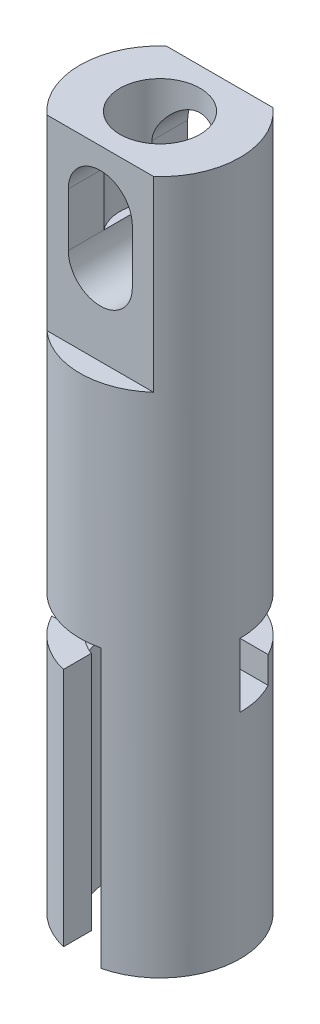
from build123d import *

# Parameters (mm, degrees)
SKETCH1_R                = 15
BOSS_EXTRUDE1_DEPTH      = 75
CUT_EXTRUDE1_DEPTH       = 52
CUT_EXTRUDE2_DEPTH       = 3.5
SKETCH9_R                = 10
CUT_EXTRUDE12_DEPTH      = 70
SKETCH17_W               = 7
SKETCH17_H               = 12
CUT_EXTRUDE19_DEPTH      = 15
SKETCH19_W               = 7
SKETCH19_H               = 12
CUT_EXTRUDE20_DEPTH      = 15
SKETCH20_R               = 7.5
CUT_EXTRUDE21_DEPTH      = 40
CUT_EXTRUDE25_DEPTH      = 152.492574075
CUT_EXTRUDE25_DEPTH_BACK = 55
SKETCH21_W               = 20
SKETCH21_H               = 7.639320226
CUT_EXTRUDE28_DEPTH      = 152.492574075
CUT_EXTRUDE28_DEPTH_BACK = 10
SKETCH24_R               = 15
SKETCH25_R               = 15
CUT_EXTRUDE29_DEPTH      = 10
CUT_EXTRUDE30_DEPTH      = 81.841883926
CUT_EXTRUDE30_DEPTH_BACK = 81.841883926


with BuildPart() as part:
    # Sketch1 → Boss-Extrude1 (new, symmetric)
    with BuildSketch(Plane(origin=(0, 0, 0), x_dir=(1, 0, 0), z_dir=(0, 1, 0))):
        with Locations(Location((0, 0, 0), (0, 0, 270))):
            Circle(SKETCH1_R)
    extrude(amount=BOSS_EXTRUDE1_DEPTH, both=True)

    # Sketch2 → Cut-Extrude1 (cut)
    with BuildSketch(Plane.XZ.offset(75)):
        with BuildLine():
            Line((3.5, 15), (3.5, -15))
            ThreePointArc((3.5, -15), (0, -18.5), (-3.5, -15))
            Line((-3.5, -15), (-3.5, 15))
            ThreePointArc((-3.5, 15), (0, 18.5), (3.5, 15))
        make_face()
    extrude(amount=-CUT_EXTRUDE1_DEPTH, mode=Mode.SUBTRACT)

    # Sketch3 → Cut-Extrude2 (cut, symmetric)
    with BuildSketch(Plane(origin=(0, -26.5, 0), x_dir=(1, 0, 0), z_dir=(0, 1, 0))):
        Polygon((-14.980069936, 0), (-15.328117643, -9.993941304), (-0.348047707, -16.993941304), (0, -7), align=None)
        Polygon((15, 0), (0, 7), (0.348047707, 16.993941304), (15.348047707, 9.993941304), align=None)
    extrude(amount=CUT_EXTRUDE2_DEPTH, both=True, mode=Mode.SUBTRACT)

    # Sketch9 → Cut-Extrude12 (cut)
    with BuildSketch(Plane.XZ.offset(75)):
        with Locations(Location((0, 0, 0), (0, 0, 270))):
            Circle(SKETCH9_R)
    extrude(amount=-CUT_EXTRUDE12_DEPTH, mode=Mode.SUBTRACT)

    # Sketch17 → Cut-Extrude19 (cut)
    with BuildSketch(Plane(origin=(15, 0, 0), x_dir=(0, 0, -1), z_dir=(1, 0, 0))):
        with Locations((3.5, -29)):
            Rectangle(SKETCH17_W, SKETCH17_H)
    extrude(amount=-CUT_EXTRUDE19_DEPTH, mode=Mode.SUBTRACT)

    # Sketch19 → Cut-Extrude20 (cut)
    with BuildSketch(Plane.ZY.offset(15)):
        with Locations((3.5, -29)):
            Rectangle(SKETCH19_W, SKETCH19_H)
    extrude(amount=-CUT_EXTRUDE20_DEPTH, mode=Mode.SUBTRACT)

    # Sketch20 → Cut-Extrude21 (cut)
    with BuildSketch(Plane(origin=(0, 75, 0), x_dir=(1, 0, 0), z_dir=(0, 1, 0))):
        with Locations(Location((0, 0, 0), (0, 0, 270))):
            Circle(SKETCH20_R)
    extrude(amount=-CUT_EXTRUDE21_DEPTH, mode=Mode.SUBTRACT)

    # Sketch21 → Cut-Extrude25 (cut, two sides: drawn at the far end of the back side and taken through both)
    with BuildSketch(Plane(origin=(0, 75, 0), x_dir=(1, 0, 0), z_dir=(0, 1, 0)).offset(-CUT_EXTRUDE25_DEPTH_BACK)):
        with Locations((0, 15)):
            Rectangle(SKETCH21_W, SKETCH21_H)
        with Locations((0, -15)):
            Rectangle(SKETCH21_W, SKETCH21_H)
    extrude(amount=CUT_EXTRUDE25_DEPTH + CUT_EXTRUDE25_DEPTH_BACK, mode=Mode.SUBTRACT)

    # Sketch24 → Cut-Extrude28 (cut, two sides: drawn at the far end of the back side and taken through both)
    with BuildSketch(Plane(origin=(0, 75, 0), x_dir=(1, 0, 0), z_dir=(0, 1, 0)).offset(-CUT_EXTRUDE28_DEPTH_BACK)):
        with Locations(Location((0, 0, 0), (0, 0, 76.506601178))):
            Circle(SKETCH24_R)
    extrude(amount=CUT_EXTRUDE28_DEPTH + CUT_EXTRUDE28_DEPTH_BACK, mode=Mode.SUBTRACT)

    # Sketch25 → Cut-Extrude29 (cut)
    with BuildSketch(Plane(origin=(0, 65, 0), x_dir=(1, 0, 0), z_dir=(0, 1, 0))):
        with Locations(Location((0, 0, 0), (0, 0, 76.506601178))):
            Circle(SKETCH25_R)
    extrude(amount=-CUT_EXTRUDE29_DEPTH, mode=Mode.SUBTRACT)

    # Sketch26 → Cut-Extrude30 (cut, two sides: drawn at the far end of the back side and taken through both)
    with BuildSketch(Plane.XY.offset(11.180339887).offset(-CUT_EXTRUDE30_DEPTH_BACK)):
        with BuildLine():
            Line((6, 45), (6, 35))
            ThreePointArc((6, 35), (0, 29), (-6, 35))
            Line((-6, 35), (-6, 45))
            ThreePointArc((-6, 45), (0, 51), (6, 45))
        make_face()
    extrude(amount=CUT_EXTRUDE30_DEPTH + CUT_EXTRUDE30_DEPTH_BACK, mode=Mode.SUBTRACT)


solid = part.part
